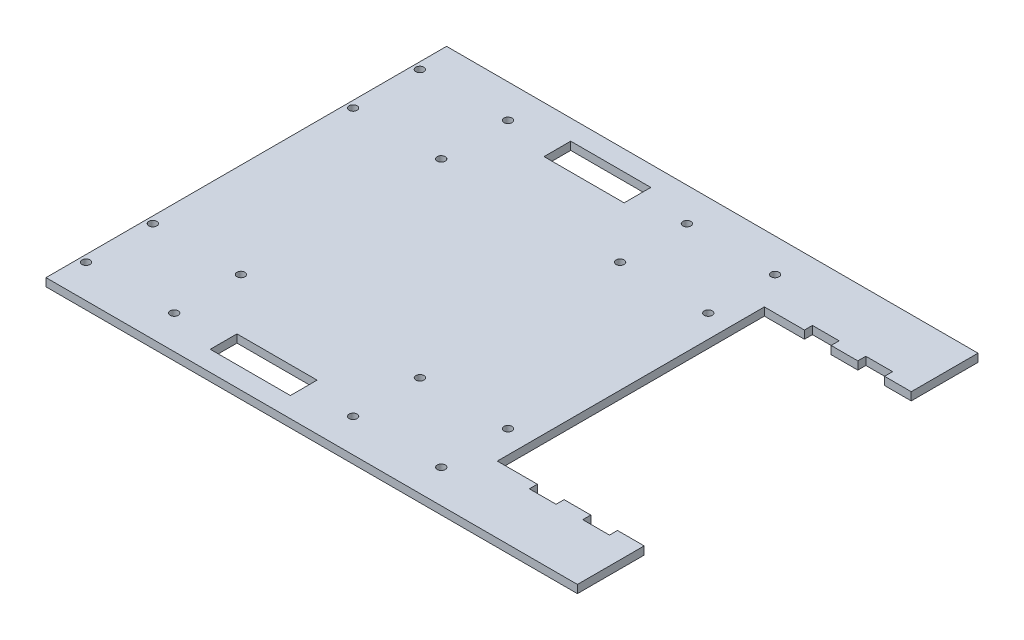
from build123d import *

# Parameters (mm, degrees)
SKETCH2_W           = 180
SKETCH2_H           = 150
BOSS_EXTRUDE1_DEPTH = 3
SKETCH4_R           = 1.5
CUT_EXTRUDE1_DEPTH  = 3
SKETCH5_W           = 30
SKETCH5_H           = 100
CUT_EXTRUDE2_DEPTH  = 3
SKETCH7_W           = 40
SKETCH7_H           = 25
BOSS_EXTRUDE4_DEPTH = 3
SKETCH8_W           = 10
SKETCH8_H           = 3
CUT_EXTRUDE4_DEPTH  = 10
SKETCH9_W           = 21
SKETCH9_H           = 150
CUT_EXTRUDE5_DEPTH  = 10
SKETCH10_W          = 30
SKETCH10_H          = 10
CUT_EXTRUDE6_DEPTH  = 10


with BuildPart() as part:
    # Sketch2 → Boss-Extrude1 (new body)
    with BuildSketch(Plane(origin=(0, 0, 0), x_dir=(1, 0, 0), z_dir=(0, 1, 0))):
        Rectangle(SKETCH2_W, SKETCH2_H)
    extrude(amount=BOSS_EXTRUDE1_DEPTH)

    # Sketch4 → Cut-Extrude1 (cut)
    with BuildSketch(Plane(origin=(0, 3, 0), x_dir=(1, 0, 0), z_dir=(0, 1, 0))):
        with Locations(Location((-66.5, -62.49, 0), (0, 0, 270))):
            Circle(SKETCH4_R)
        with Locations(Location((-66.5, -37.49, 0), (0, 0, 270))):
            Circle(SKETCH4_R)
        with Locations(Location((-33.5, -62.49, 0), (0, 0, 90))):
            Circle(SKETCH4_R)
        with Locations(Location((-33.5, -37.49, 0), (0, 0, 90))):
            Circle(SKETCH4_R)
        with Locations(Location((-66.5, 62.49, 0), (0, 0, 90))):
            Circle(SKETCH4_R)
        with Locations(Location((-66.5, 37.49, 0), (0, 0, 90))):
            Circle(SKETCH4_R)
        with Locations(Location((-33.5, 62.49, 0), (0, 0, 270))):
            Circle(SKETCH4_R)
        with Locations(Location((-33.5, 37.49, 0), (0, 0, 270))):
            Circle(SKETCH4_R)
        with Locations(Location((66.5, -62.49, 0), (0, 0, 90))):
            Circle(SKETCH4_R)
        with Locations(Location((33.5, -62.49, 0), (0, 0, 270))):
            Circle(SKETCH4_R)
        with Locations(Location((33.5, -37.49, 0), (0, 0, 270))):
            Circle(SKETCH4_R)
        with Locations(Location((66.5, -37.49, 0), (0, 0, 90))):
            Circle(SKETCH4_R)
        with Locations(Location((66.5, 37.49, 0), (0, 0, 270))):
            Circle(SKETCH4_R)
        with Locations(Location((66.5, 62.49, 0), (0, 0, 270))):
            Circle(SKETCH4_R)
        with Locations(Location((33.5, 62.49, 0), (0, 0, 90))):
            Circle(SKETCH4_R)
        with Locations(Location((33.5, 37.49, 0), (0, 0, 90))):
            Circle(SKETCH4_R)
    extrude(amount=-CUT_EXTRUDE1_DEPTH, mode=Mode.SUBTRACT)

    # Sketch5 → Cut-Extrude2 (cut)
    with BuildSketch(Plane.XZ):
        with Locations((90, 0)):
            Rectangle(SKETCH5_W, SKETCH5_H)
    extrude(amount=-CUT_EXTRUDE2_DEPTH, mode=Mode.SUBTRACT)

    # Sketch7 → Boss-Extrude4 (add)
    with BuildSketch(Plane(origin=(0, 3, 0), x_dir=(1, 0, 0), z_dir=(0, 1, 0))):
        with Locations((110, -62.5)):
            Rectangle(SKETCH7_W, SKETCH7_H)
        with Locations((110, 62.5)):
            Rectangle(SKETCH7_W, SKETCH7_H)
    extrude(amount=-BOSS_EXTRUDE4_DEPTH)

    # Sketch8 → Cut-Extrude4 (cut)
    with BuildSketch(Plane(origin=(0, 3, 0), x_dir=(1, 0, 0), z_dir=(0, 1, 0))):
        with Locations((115, 51.5)):
            Rectangle(SKETCH8_W, SKETCH8_H)
        with Locations((95, 51.5)):
            Rectangle(SKETCH8_W, SKETCH8_H)
        with Locations((115, -51.5)):
            Rectangle(SKETCH8_W, SKETCH8_H)
        with Locations((95, -51.5)):
            Rectangle(SKETCH8_W, SKETCH8_H)
    extrude(amount=-CUT_EXTRUDE4_DEPTH, mode=Mode.SUBTRACT)

    # Sketch9 → Cut-Extrude5 (cut)
    with BuildSketch(Plane(origin=(0, 3, 0), x_dir=(1, 0, 0), z_dir=(0, 1, 0))):
        with Locations((-79.5, 0)):
            Rectangle(SKETCH9_W, SKETCH9_H)
    extrude(amount=-CUT_EXTRUDE5_DEPTH, mode=Mode.SUBTRACT)

    # Sketch10 → Cut-Extrude6 (cut)
    with BuildSketch(Plane(origin=(0, 3, 0), x_dir=(1, 0, 0), z_dir=(0, 1, 0))):
        with Locations((0, -62.49)):
            Rectangle(SKETCH10_W, SKETCH10_H)
        with Locations((0, 62.49)):
            Rectangle(SKETCH10_W, SKETCH10_H)
    extrude(amount=-CUT_EXTRUDE6_DEPTH, mode=Mode.SUBTRACT)


solid = part.part
